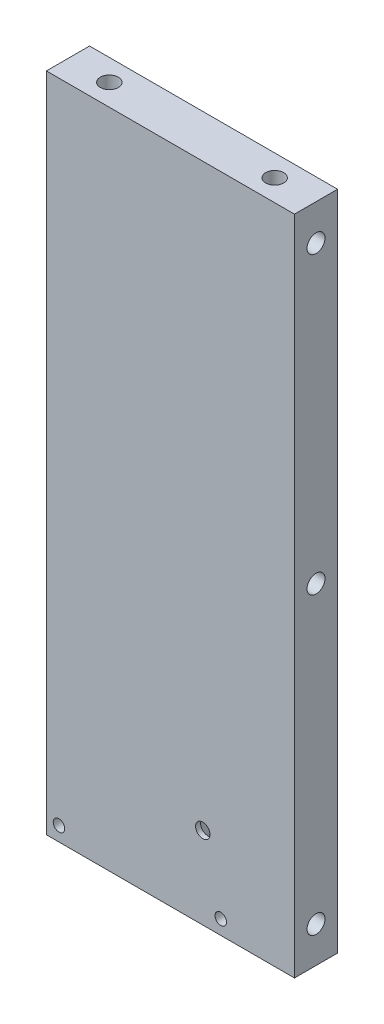
from build123d import *

# Parameters (mm, degrees)
SKETCH_1_W             = 34.5
SKETCH_1_H             = 92
EXTRUDE_717_DEPTH      = 6
HOLE_WIZARD_1_M3_D     = 2.5
HOLE_WIZARD_1_M3_DEPTH = 6
HOLE_WIZARD_1_M3_TIP   = 0.751075774
HOLE_WIZARD_2_M3_D     = 2.5
HOLE_WIZARD_2_M3_DEPTH = 6
HOLE_WIZARD_2_M3_TIP   = 0.751075774
HOLE_WIZARD_M3_D       = 2.5
HOLE_WIZARD_M3_DEPTH   = 6
HOLE_WIZARD_M3_TIP     = 0.751075774
HOLE_WIZARD_M3_2_D     = 2.5
HOLE_WIZARD_M3_2_DEPTH = 6
HOLE_WIZARD_M3_2_TIP   = 0.751075774
HOLE_WIZARD_M21_D      = 1.6


with BuildPart() as part:
    # Эскиз1 → Extrude 717 (new body)
    with BuildSketch(Plane.XY):
        Rectangle(SKETCH_1_W, SKETCH_1_H)
    extrude(amount=EXTRUDE_717_DEPTH)

    # Сторона-1-M3
    with Locations(Plane(origin=(17.25, 0, 0), x_dir=(0, 0, -1), z_dir=(1, 0, 0))):
        with Locations((-3, 41), (-3, 0), (-3, -41)):
            Hole(HOLE_WIZARD_1_M3_D / 2, depth=HOLE_WIZARD_1_M3_DEPTH)
            with Locations((0, 0, -(HOLE_WIZARD_1_M3_DEPTH + HOLE_WIZARD_1_M3_TIP / 2))):  # 118° drill point
                Cone(0, HOLE_WIZARD_1_M3_D / 2, HOLE_WIZARD_1_M3_TIP, mode=Mode.SUBTRACT)

    # Сторона-2-M3
    with Locations(Plane.ZY.offset(17.25)):
        with Locations((3, 0), (3, 41), (3, -41)):
            Hole(HOLE_WIZARD_2_M3_D / 2, depth=HOLE_WIZARD_2_M3_DEPTH)
            with Locations((0, 0, -(HOLE_WIZARD_2_M3_DEPTH + HOLE_WIZARD_2_M3_TIP / 2))):  # 118° drill point
                Cone(0, HOLE_WIZARD_2_M3_D / 2, HOLE_WIZARD_2_M3_TIP, mode=Mode.SUBTRACT)

    # Hole Wizard M3
    with Locations(Plane(origin=(0, -46, 0), x_dir=(-1, 0, 0), z_dir=(0, -1, 0))):
        with Locations((11.5, -3), (-11.5, -3)):
            Hole(HOLE_WIZARD_M3_D / 2, depth=HOLE_WIZARD_M3_DEPTH)
            with Locations((0, 0, -(HOLE_WIZARD_M3_DEPTH + HOLE_WIZARD_M3_TIP / 2))):  # 118° drill point
                Cone(0, HOLE_WIZARD_M3_D / 2, HOLE_WIZARD_M3_TIP, mode=Mode.SUBTRACT)

    # Hole Wizard M3 2
    with Locations(Plane(origin=(0, 46, 0), x_dir=(1, 0, 0), z_dir=(0, 1, 0))):
        with Locations((-11.5, -3), (11.5, -3)):
            Hole(HOLE_WIZARD_M3_2_D / 2, depth=HOLE_WIZARD_M3_2_DEPTH)
            with Locations((0, 0, -(HOLE_WIZARD_M3_2_DEPTH + HOLE_WIZARD_M3_2_TIP / 2))):  # 118° drill point
                Cone(0, HOLE_WIZARD_M3_2_D / 2, HOLE_WIZARD_M3_2_TIP, mode=Mode.SUBTRACT)

    # Эскиз9 → Натяжение-M6 (revolve, cut)
    with BuildSketch(Plane(origin=(4.5, -34.6, 0), x_dir=(0, 1, 0), z_dir=(1, 0, 0))):
        Polygon((0, 0), (0, 6), (1, 6), (1, 5.3), (6.3, 0), align=None)
    revolve(axis=Axis((4.5, -34.6, -6.35), (0, 0, 1)), mode=Mode.SUBTRACT)

    # Отверстие обработанное метчиком M21 (through all)
    with Locations(Plane.XY.offset(6)):
        with Locations((-15.5, -44), (7, -44)):
            Hole(HOLE_WIZARD_M21_D / 2)


solid = part.part
